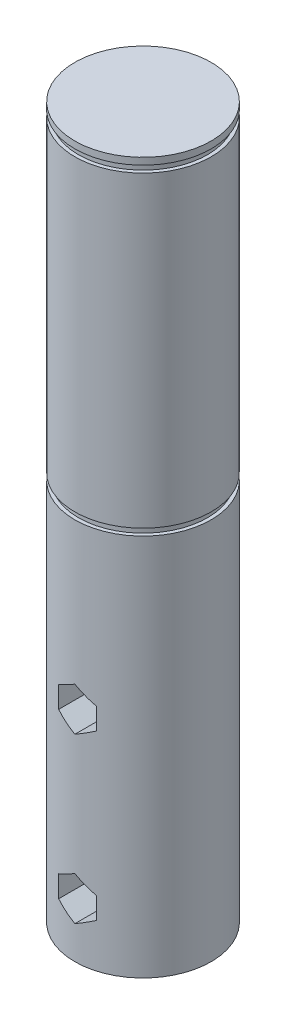
from build123d import *

# Parameters (mm, degrees)
SKETCH_1_R          = 9.975
EXTRUDE_1_DEPTH     = 40
SKETCH_5_R          = 9.975
F_16MM_DEPTH        = 16
SKETCH_6_R          = 9.45
EXTRUDE_1_2_DEPTH   = 1
SKETCH_7_R          = 9.975
EXTRUDE_4_DEPTH     = 45
SKETCH_8_R          = 9.45
EXTRUDE_2_DEPTH     = 1
SKETCH_9_R          = 9.975
EXTRUDE_6_DEPTH     = 1
CUT_EXTRUDE_1_DEPTH = 8


with BuildPart() as part:
    # 草图1 → Extrude 1 (new body)
    with BuildSketch(Plane(origin=(0, 0, 0), x_dir=(1, 0, 0), z_dir=(0, 1, 0))):
        with Locations(Location((5.9, 0, 0), (0, 0, 270))):
            Circle(SKETCH_1_R)
    extrude(amount=EXTRUDE_1_DEPTH)

    # 草图5 → 16mm 铰链间距 (add)
    with BuildSketch(Plane(origin=(0, 40, 0), x_dir=(1, 0, 0), z_dir=(0, 1, 0))):
        with Locations(Location((5.9, 0, 0), (0, 0, 270))):
            Circle(SKETCH_5_R)
    extrude(amount=F_16MM_DEPTH)

    # 草图6 → Extrude 1 2 (add)
    with BuildSketch(Plane(origin=(0, 56, 0), x_dir=(1, 0, 0), z_dir=(0, 1, 0))):
        with Locations(Location((5.9, 0, 0), (0, 0, 270))):
            Circle(SKETCH_6_R)
    extrude(amount=EXTRUDE_1_2_DEPTH)

    # 草图7 → 凸台-拉伸4 (add)
    with BuildSketch(Plane(origin=(0, 57, 0), x_dir=(1, 0, 0), z_dir=(0, 1, 0))):
        with Locations(Location((5.9, 0, 0), (0, 0, 270))):
            Circle(SKETCH_7_R)
    extrude(amount=EXTRUDE_4_DEPTH)

    # 草图8 → 卡簧2 (add)
    with BuildSketch(Plane(origin=(0, 102, 0), x_dir=(1, 0, 0), z_dir=(0, 1, 0))):
        with Locations(Location((5.9, 0, 0), (0, 0, 270))):
            Circle(SKETCH_8_R)
    extrude(amount=EXTRUDE_2_DEPTH)

    # 草图9 → 凸台-拉伸6 (add)
    with BuildSketch(Plane(origin=(0, 103, 0), x_dir=(1, 0, 0), z_dir=(0, 1, 0))):
        with Locations(Location((5.9, 0, 0), (0, 0, 270))):
            Circle(SKETCH_9_R)
    extrude(amount=EXTRUDE_6_DEPTH)

    # 草图10 → 切除-拉伸1 (cut)
    with BuildSketch(Plane.XY.offset(9.975)):
        Polygon((8.65, 9.58771324), (5.9, 11.175426481), (3.15, 9.58771324), (3.15, 6.41228676), (5.9, 4.824573519), (8.65, 6.41228676), align=None)
    cut_extrude_1 = extrude(amount=-CUT_EXTRUDE_1_DEPTH, mode=Mode.SUBTRACT)

    # 镜向2: 切除-拉伸1 across plane
    add(cut_extrude_1.mirror(Plane(origin=(0, 20, 0), x_dir=(0, 0, 1), z_dir=(0, -1, 0))), mode=Mode.SUBTRACT)


solid = part.part
